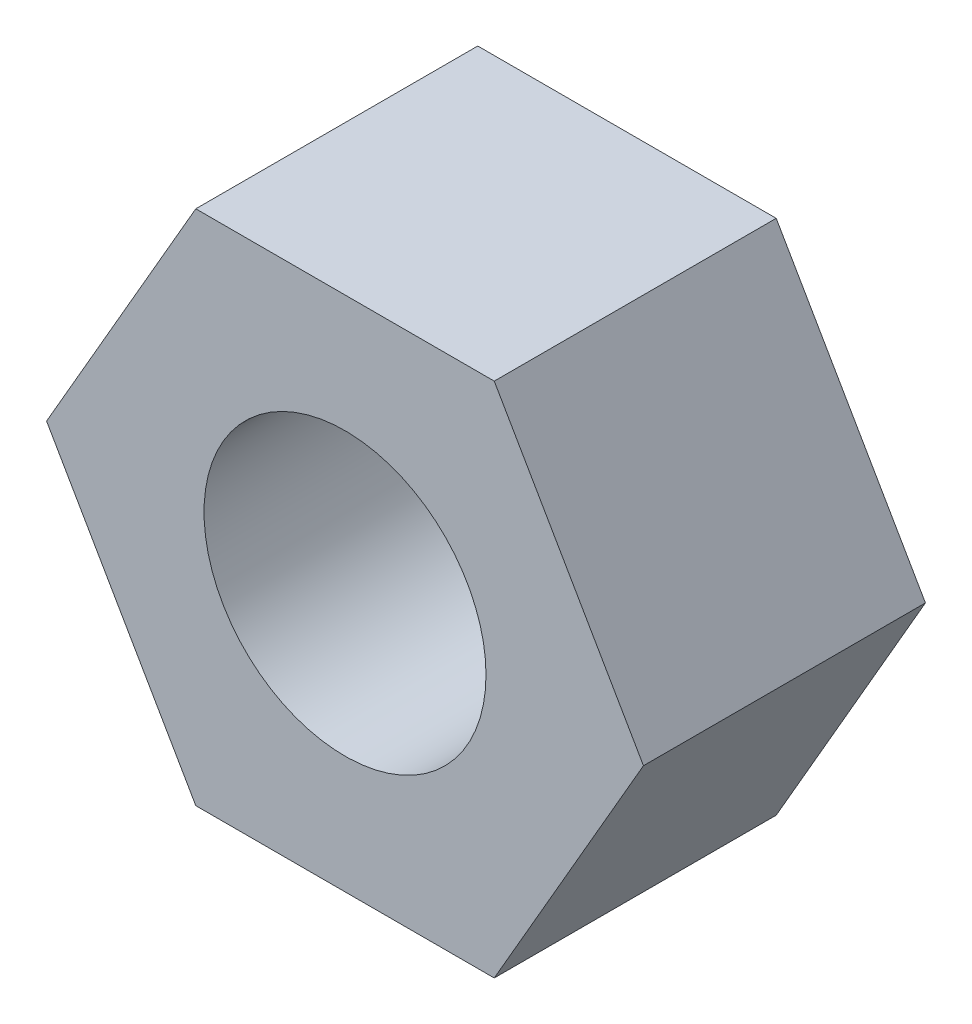
from build123d import *

# Parameters (mm, degrees)
SKETCH_2_R      = 1.5
EXTRUDE_1_DEPTH = 3


with BuildPart() as part:
    # ｽｹｯﾁ2 → ﾎﾞｽ - 押し出し1 (new body)
    with BuildSketch(Plane.XY):
        Polygon((3.175426481, 0), (1.58771324, 2.75), (-1.58771324, 2.75), (-3.175426481, 0), (-1.58771324, -2.75), (1.58771324, -2.75), align=None)
        Circle(SKETCH_2_R, mode=Mode.SUBTRACT)
    extrude(amount=EXTRUDE_1_DEPTH)


solid = part.part
